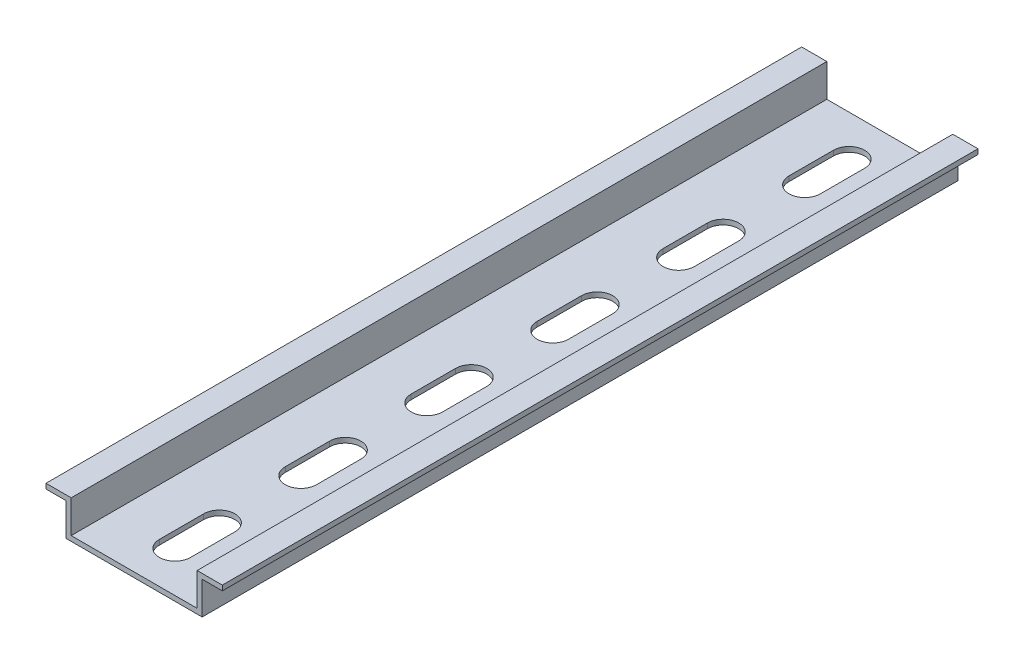
from build123d import *

# Parameters (mm, degrees)
BOSS_EXTRUDE1_DEPTH  = 150
CUT_EXTRUDE1_DEPTH   = 152.20350525
LPATTERN1_COUNT      = 6
LPATTERN1_PITCH      = 25
MIRROR2_COPY_1_DEPTH = 152.20350525
MIRROR2_COPY_2_DEPTH = 152.20350525
MIRROR2_COPY_3_DEPTH = 152.20350525
MIRROR2_COPY_4_DEPTH = 152.20350525
MIRROR2_COPY_5_DEPTH = 152.20350525


with BuildPart() as part:
    # Sketch1 → Boss-Extrude1 (new body)
    with BuildSketch(Plane.XY):
        Polygon((0, 0), (13.5, 0), (13.5, 6.5), (17.5, 6.5), (17.5, 7.5), (12.5, 7.5), (12.5, 1), (0, 1), align=None)
    boss_extrude1 = extrude(amount=BOSS_EXTRUDE1_DEPTH)

    # Sketch2 → Cut-Extrude1 (cut, through all)
    with BuildSketch(Plane(origin=(0, 0, 0), x_dir=(1, 0, 0), z_dir=(0, 1, 0))):
        with BuildLine():
            Line((3.1, -8.1), (3.1, -16.9))
            ThreePointArc((3.1, -16.9), (0, -20), (-3.1, -16.9))
            Line((-3.1, -16.9), (-3.1, -8.1))
            ThreePointArc((-3.1, -8.1), (0, -5), (3.1, -8.1))
        make_face()
    cut_extrude1 = extrude(amount=CUT_EXTRUDE1_DEPTH, mode=Mode.SUBTRACT)

    # LPattern1: Cut-Extrude1 ×6
    with Locations(*[(0, 0, i * LPATTERN1_PITCH) for i in range(1, LPATTERN1_COUNT)]):
        add(cut_extrude1, mode=Mode.SUBTRACT)

    # Mirror2: Boss-Extrude1, Cut-Extrude1 across plane
    add(boss_extrude1.mirror(Plane(origin=(0, 0, 0), x_dir=(0, 0, 1), z_dir=(1, 0, 0))))
    add(cut_extrude1.mirror(Plane(origin=(0, 0, 0), x_dir=(0, 0, 1), z_dir=(1, 0, 0))), mode=Mode.SUBTRACT)

    # Mirror2 copy 1 sketch → Mirror2 copy 1 (cut, through all)
    with BuildSketch(Plane(origin=(0, 0, 25), x_dir=(-1, 0, 0), z_dir=(0, 1, 0))):
        with BuildLine():
            Line((3.1, 8.1), (3.1, 16.9))
            ThreePointArc((3.1, 16.9), (0, 20), (-3.1, 16.9))
            Line((-3.1, 16.9), (-3.1, 8.1))
            ThreePointArc((-3.1, 8.1), (0, 5), (3.1, 8.1))
        make_face()
    extrude(amount=MIRROR2_COPY_1_DEPTH, mode=Mode.SUBTRACT)

    # Mirror2 copy 2 sketch → Mirror2 copy 2 (cut, through all)
    with BuildSketch(Plane(origin=(0, 0, 50), x_dir=(-1, 0, 0), z_dir=(0, 1, 0))):
        with BuildLine():
            Line((3.1, 8.1), (3.1, 16.9))
            ThreePointArc((3.1, 16.9), (0, 20), (-3.1, 16.9))
            Line((-3.1, 16.9), (-3.1, 8.1))
            ThreePointArc((-3.1, 8.1), (0, 5), (3.1, 8.1))
        make_face()
    extrude(amount=MIRROR2_COPY_2_DEPTH, mode=Mode.SUBTRACT)

    # Mirror2 copy 3 sketch → Mirror2 copy 3 (cut, through all)
    with BuildSketch(Plane(origin=(0, 0, 75), x_dir=(-1, 0, 0), z_dir=(0, 1, 0))):
        with BuildLine():
            Line((3.1, 8.1), (3.1, 16.9))
            ThreePointArc((3.1, 16.9), (0, 20), (-3.1, 16.9))
            Line((-3.1, 16.9), (-3.1, 8.1))
            ThreePointArc((-3.1, 8.1), (0, 5), (3.1, 8.1))
        make_face()
    extrude(amount=MIRROR2_COPY_3_DEPTH, mode=Mode.SUBTRACT)

    # Mirror2 copy 4 sketch → Mirror2 copy 4 (cut, through all)
    with BuildSketch(Plane(origin=(0, 0, 100), x_dir=(-1, 0, 0), z_dir=(0, 1, 0))):
        with BuildLine():
            Line((3.1, 8.1), (3.1, 16.9))
            ThreePointArc((3.1, 16.9), (0, 20), (-3.1, 16.9))
            Line((-3.1, 16.9), (-3.1, 8.1))
            ThreePointArc((-3.1, 8.1), (0, 5), (3.1, 8.1))
        make_face()
    extrude(amount=MIRROR2_COPY_4_DEPTH, mode=Mode.SUBTRACT)

    # Mirror2 copy 5 sketch → Mirror2 copy 5 (cut, through all)
    with BuildSketch(Plane(origin=(0, 0, 125), x_dir=(-1, 0, 0), z_dir=(0, 1, 0))):
        with BuildLine():
            Line((3.1, 8.1), (3.1, 16.9))
            ThreePointArc((3.1, 16.9), (0, 20), (-3.1, 16.9))
            Line((-3.1, 16.9), (-3.1, 8.1))
            ThreePointArc((-3.1, 8.1), (0, 5), (3.1, 8.1))
        make_face()
    extrude(amount=MIRROR2_COPY_5_DEPTH, mode=Mode.SUBTRACT)


solid = part.part
